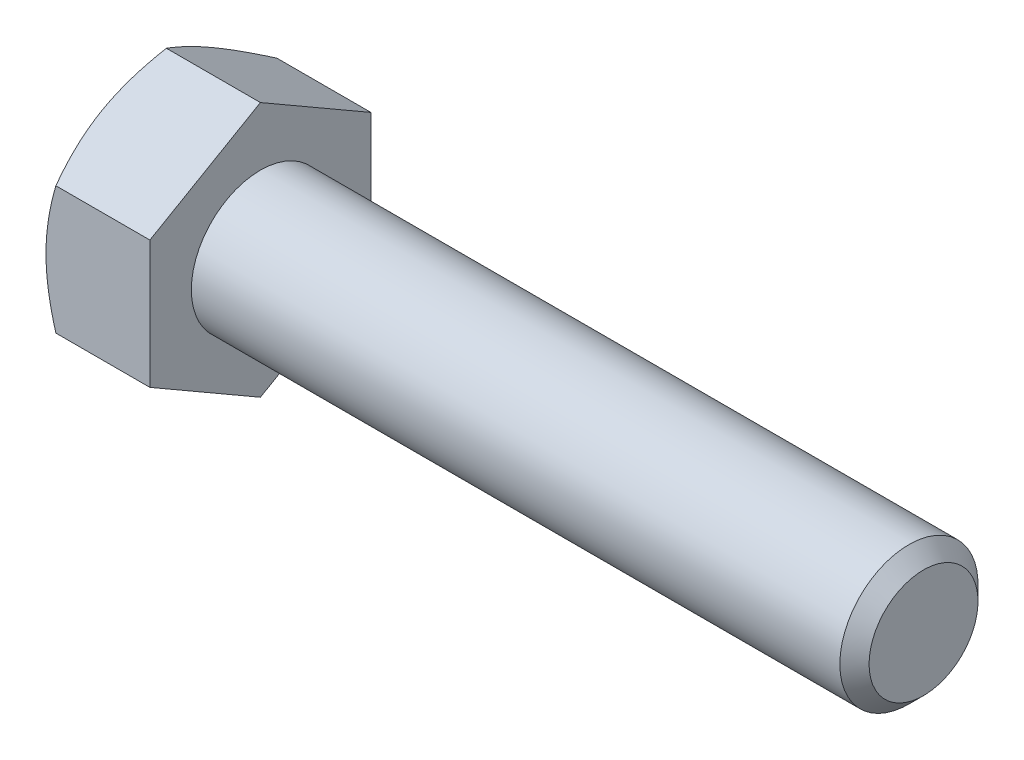
from build123d import *

# Parameters (mm, degrees)
BASEHEAD_DEPTH = 5.969


with BuildPart() as part:
    # Sketch1 → BaseHead (new body)
    with BuildSketch(Plane(origin=(0, 0, 0), x_dir=(0, 0, -1), z_dir=(1, 0, 0))):
        Polygon((6.35, 3.666174209), (6.35, -3.666174209), (0, -7.332348419), (-6.35, -3.666174209), (-6.35, 3.666174209), (0, 7.332348419), align=None)
    extrude(amount=BASEHEAD_DEPTH)

    # BodySke → BaseBody (revolve)
    with BuildSketch(Plane.XY, mode=Mode.PRIVATE) as basebody_sk:
        Polygon((0, 0), (44.069, 0), (44.069, 3.12928), (43.22953, 3.96875), (0, 3.96875), align=None)
    revolve(basebody_sk.sketch.rotate(Axis((0, 0, 0), (1, 0, 0)), 90), axis=Axis((0, 0, 0), (1, 0, 0)))

    # Sketch3 → HeadChamfer (revolve, cut)
    with BuildSketch(Plane.XY):
        Polygon((0, 6.35), (4.233333333, 13.682348419), (4.233333333, 20.032348419), (-12.7, 20.032348419), (-12.7, 6.35), align=None)
    revolve(axis=Axis((0, 0, 0), (1, 0, 0)), mode=Mode.SUBTRACT)


solid = part.part
